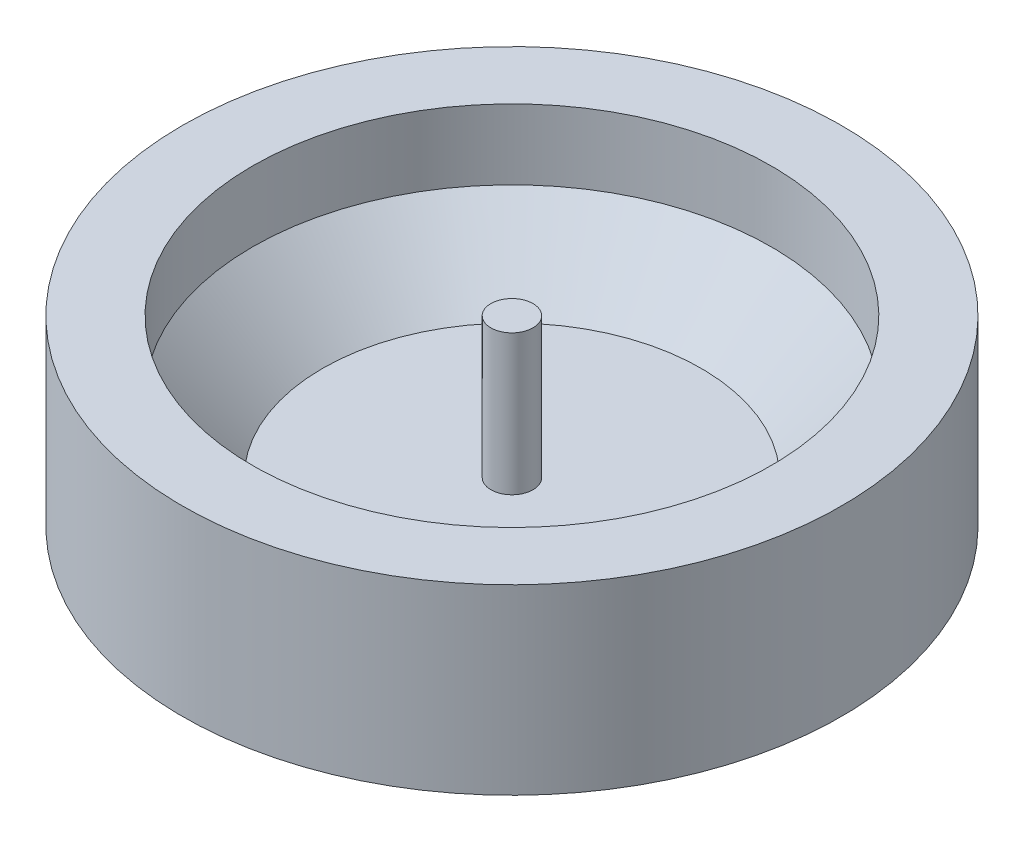
from build123d import *


with BuildPart() as part:
    # Esquisse1 → Révolution1 (revolve)
    with BuildSketch(Plane.XY):
        Polygon((-18.5, 5), (-18.5, 10), (-23.5, 10), (-23.5, 0), (-23.5, -3), (0, -3), (0, 10), (-1.5, 10), (-1.5, 0), (-13.5, 0), align=None)
    revolve(axis=Axis((0, 10, 0), (0, -1, 0)))


solid = part.part
